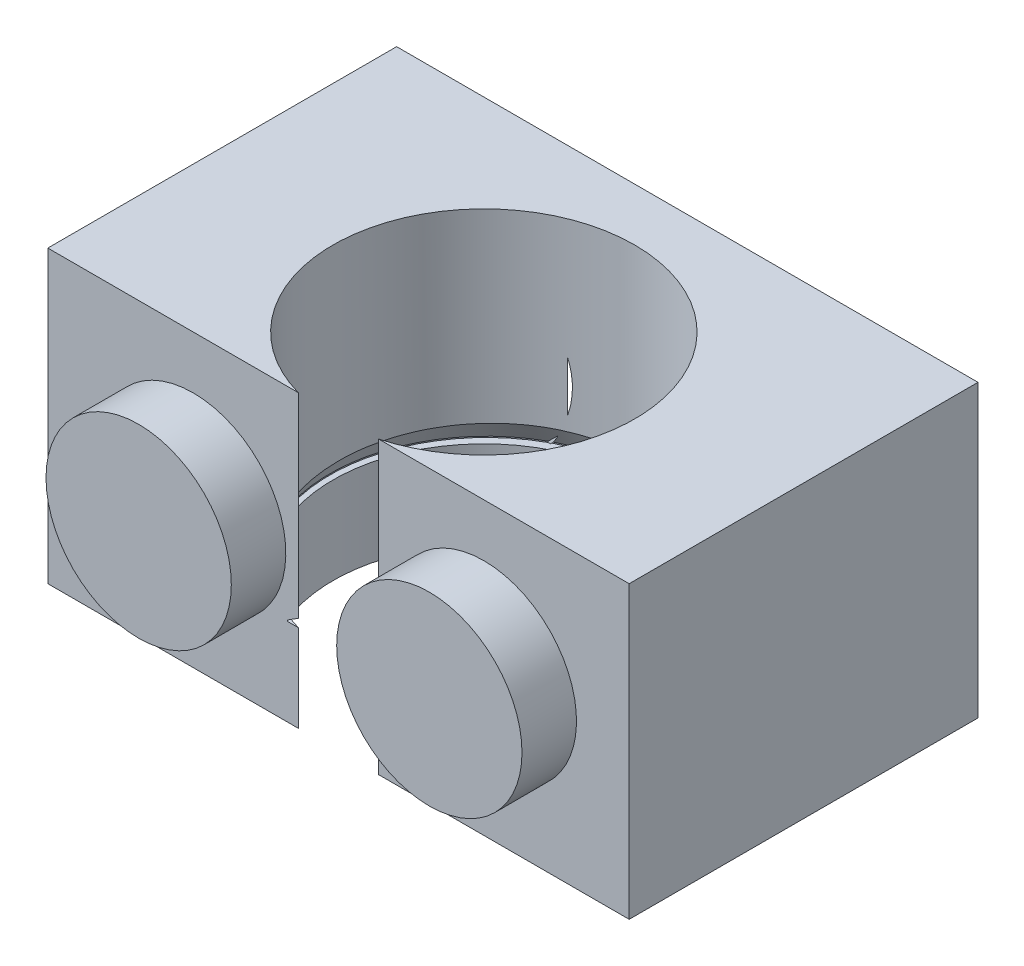
from build123d import *

# Parameters (mm, degrees)
BOSS_EXTRUDE1_DEPTH = 8
SKETCH3_R           = 2.55
BOSS_EXTRUDE2_DEPTH = 1.5
CUT_EXTRUDE1_START  = -9.6
SKETCH3_3_R         = 2.55
CUT_EXTRUDE1_DEPTH  = 1.75


with BuildPart() as part:
    # Sketch1 → Boss-Extrude1 (new body)
    with BuildSketch(Plane(origin=(0, -47.198737708, 1.758e-06), x_dir=(1, 0, 0), z_dir=(1.517238059440084e-15, 0.9999999999999994, -3.725290356966477e-08))):
        with BuildLine():
            Line((7.999998093, 18.45445013), (7.999998093, 8.85445013))
            Line((7.999998093, 8.85445013), (14.894330873, 8.85445013))
            ThreePointArc((14.894330873, 8.85445013), (13.486635699, 16.156799215), (20.149998093, 12.85445013))
            ThreePointArc((20.149998093, 12.85445013), (19.302347178, 10.341087736), (17.105665312, 8.85445013))
            Line((17.105665312, 8.85445013), (23.999998093, 8.85445013))
            Line((23.999998093, 8.85445013), (23.999998093, 18.45445013))
            Line((23.999998093, 18.45445013), (7.999998093, 18.45445013))
        make_face()
    extrude(amount=BOSS_EXTRUDE1_DEPTH)

    # Sketch2 → Cut-Revolve1 (revolve, cut)
    with BuildSketch(Plane.ZY.offset(-15.999998093)):
        Polygon((-8.854448524, -44.263738058), (-8.619448462, -44.767697268), (-8.619448461, -44.798738029), (-8.854448524, -44.798738345), align=None)
    revolve(axis=Axis((15.999998093, -46.259040624, -12.929448669), (0, -1, 0)), mode=Mode.SUBTRACT)

    # Sketch3 → Boss-Extrude2 (add)
    with BuildSketch(Plane(origin=(0, -3.3e-07, -8.85445013), x_dir=(1, 0, 0), z_dir=(0, 3.725290356966478e-08, 0.9999999999999994))):
        with Locations(Location((11.999998093, -43.198737708, 0), (0, 0, 90))):
            Circle(SKETCH3_R)
        with Locations(Location((19.999998093, -43.198737708, 0), (0, 0, 90))):
            Circle(SKETCH3_R)
    extrude(amount=BOSS_EXTRUDE2_DEPTH)

    # Sketch3<3> → Cut-Extrude1 (cut)
    with BuildSketch(Plane(origin=(0, -3.3e-07, -8.85445013), x_dir=(1, 0, 0), z_dir=(0, 3.725290356966478e-08, 0.9999999999999994)).offset(CUT_EXTRUDE1_START)):
        with Locations(Location((11.999998093, -43.198737708, 0), (0, 0, 90))):
            Circle(SKETCH3_3_R)
        with Locations(Location((19.999998093, -43.198737708, 0), (0, 0, 90))):
            Circle(SKETCH3_3_R)
    extrude(amount=CUT_EXTRUDE1_DEPTH, mode=Mode.SUBTRACT)


solid = part.part
